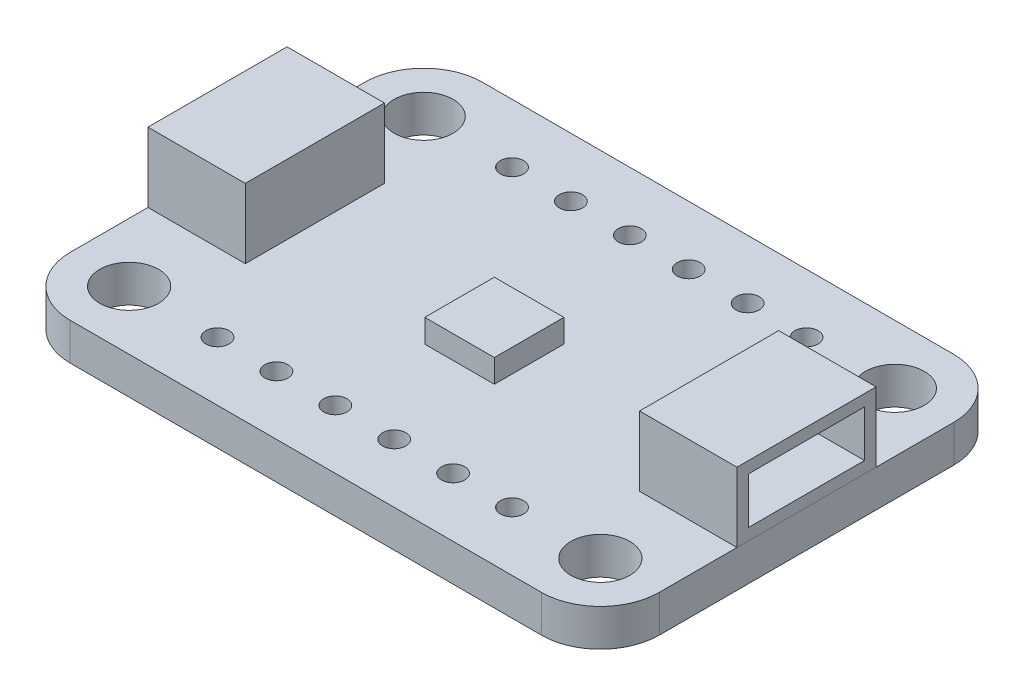
from build123d import *

# Parameters (mm, degrees)
SKETCH1_R             = 1.27
SKETCH1_R_2           = 0.5
BOSS_EXTRUDE1_DEPTH   = 1.6
SKETCH2_W             = 3
SKETCH2_H             = 3
BOSS_EXTRUDE2_DEPTH   = 1
SKETCH3_W             = 4.2
SKETCH3_H             = 6
BOSS_EXTRUDE3_DEPTH   = 3
BOSS_EXTRUDE3_2_DEPTH = 3
SHELL1_T              = -0.5
SHELL2_T              = -0.5


with BuildPart() as part:
    # Sketch1 → Boss-Extrude1 (new body)
    with BuildSketch(Plane(origin=(0, 0, 0), x_dir=(1, 0, 0), z_dir=(0, 1, 0))):
        with BuildLine():
            Line((-10.16, 8.89), (10.16, 8.89))
            ThreePointArc((10.16, 8.89), (11.956051224, 8.146051224), (12.7, 6.35))
            Line((12.7, 6.35), (12.7, -6.35))
            ThreePointArc((12.7, -6.35), (11.956051224, -8.146051224), (10.16, -8.89))
            Line((10.16, -8.89), (-10.16, -8.89))
            ThreePointArc((-10.16, -8.89), (-11.956051224, -8.146051224), (-12.7, -6.35))
            Line((-12.7, -6.35), (-12.7, 6.35))
            ThreePointArc((-12.7, 6.35), (-11.956051224, 8.146051224), (-10.16, 8.89))
        make_face()
        with Locations(Location((-10.16, 6.35, 0), (0, 0, 270))):
            Circle(SKETCH1_R, mode=Mode.SUBTRACT)
        with Locations(Location((10.16, 6.35, 0), (0, 0, 90))):
            Circle(SKETCH1_R, mode=Mode.SUBTRACT)
        with Locations(Location((-1.27, -6.35, 0), (0, 0, 90))):
            Circle(SKETCH1_R_2, mode=Mode.SUBTRACT)
        with Locations(Location((-3.81, -6.35, 0), (0, 0, 90))):
            Circle(SKETCH1_R_2, mode=Mode.SUBTRACT)
        with Locations(Location((-6.35, -6.35, 0), (0, 0, 270))):
            Circle(SKETCH1_R_2, mode=Mode.SUBTRACT)
        with Locations(Location((1.27, -6.35, 0), (0, 0, 270))):
            Circle(SKETCH1_R_2, mode=Mode.SUBTRACT)
        with Locations(Location((3.81, -6.35, 0), (0, 0, 270))):
            Circle(SKETCH1_R_2, mode=Mode.SUBTRACT)
        with Locations(Location((6.35, -6.35, 0), (0, 0, 90))):
            Circle(SKETCH1_R_2, mode=Mode.SUBTRACT)
        with Locations(Location((6.35, 6.35, 0), (0, 0, 270))):
            Circle(SKETCH1_R_2, mode=Mode.SUBTRACT)
        with Locations(Location((3.81, 6.35, 0), (0, 0, 90))):
            Circle(SKETCH1_R_2, mode=Mode.SUBTRACT)
        with Locations(Location((1.27, 6.35, 0), (0, 0, 90))):
            Circle(SKETCH1_R_2, mode=Mode.SUBTRACT)
        with Locations(Location((-1.27, 6.35, 0), (0, 0, 270))):
            Circle(SKETCH1_R_2, mode=Mode.SUBTRACT)
        with Locations(Location((-3.81, 6.35, 0), (0, 0, 270))):
            Circle(SKETCH1_R_2, mode=Mode.SUBTRACT)
        with Locations(Location((-6.35, 6.35, 0), (0, 0, 90))):
            Circle(SKETCH1_R_2, mode=Mode.SUBTRACT)
        with Locations(Location((10.16, -6.35, 0), (0, 0, 270))):
            Circle(SKETCH1_R, mode=Mode.SUBTRACT)
        with Locations(Location((-10.16, -6.35, 0), (0, 0, 90))):
            Circle(SKETCH1_R, mode=Mode.SUBTRACT)
    extrude(amount=BOSS_EXTRUDE1_DEPTH)


with BuildPart() as body_2:
    # Sketch2 → Boss-Extrude2 (new body)
    with BuildSketch(Plane(origin=(0, 1.6, 0), x_dir=(1, 0, 0), z_dir=(0, 1, 0))):
        with Locations((-0.127, -0.635)):
            Rectangle(SKETCH2_W, SKETCH2_H)
    extrude(amount=BOSS_EXTRUDE2_DEPTH)


with BuildPart() as body_3:
    # Sketch3 → Boss-Extrude3 (new body)
    with BuildSketch(Plane(origin=(0, 1.6, 0), x_dir=(1, 0, 0), z_dir=(0, 1, 0))):
        with Locations((10.6, 0)):
            Rectangle(SKETCH3_W, SKETCH3_H)
    extrude(amount=BOSS_EXTRUDE3_DEPTH)

    # Shell2
    shell2_openings = [body_3.faces().sort_by_distance(p)[0] for p in [
        (12.7, 3.1, 0),
    ]]
    offset(amount=SHELL2_T, openings=shell2_openings, kind=Kind.INTERSECTION)


with BuildPart() as body_4:
    # Sketch3 → Boss-Extrude3 2 (new body)
    with BuildSketch(Plane(origin=(0, 1.6, 0), x_dir=(1, 0, 0), z_dir=(0, 1, 0))):
        with Locations((-10.6, 0)):
            Rectangle(SKETCH3_W, SKETCH3_H)
    extrude(amount=BOSS_EXTRUDE3_2_DEPTH)

    # Shell1
    shell1_openings = [body_4.faces().sort_by_distance(p)[0] for p in [
        (-12.7, 3.1, 0),
    ]]
    offset(amount=SHELL1_T, openings=shell1_openings, kind=Kind.INTERSECTION)


solid = Compound([part.part, body_2.part, body_3.part, body_4.part])
